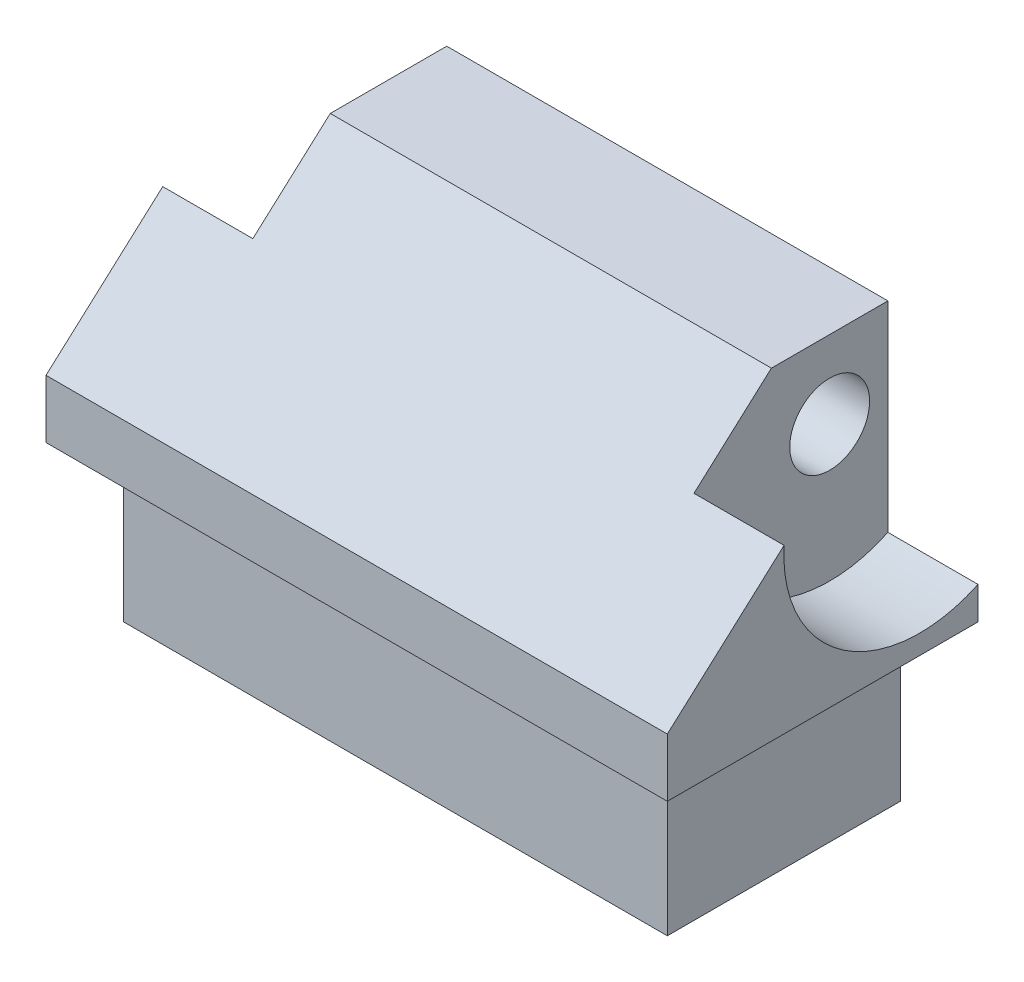
from build123d import *

# Parameters (mm, degrees)
SKETCH2_W           = 44.45
SKETCH2_H           = 19.05
BOSS_EXTRUDE1_DEPTH = 12.7
SKETCH3_W           = 50.8
SKETCH3_H           = 25.4
BOSS_EXTRUDE2_DEPTH = 3.175
BOSS_EXTRUDE3_DEPTH = 25.4
SKETCH5_R           = 11.1125
CUT_EXTRUDE1_DEPTH  = 7.366
SKETCH6_R           = 3.2639
CUT_EXTRUDE2_DEPTH  = 50.098929275


with BuildPart() as part:
    # Sketch2 → Boss-Extrude1 (new body)
    with BuildSketch(Plane(origin=(0, 0, 0), x_dir=(1, 0, 0), z_dir=(0, 1, 0))):
        Rectangle(SKETCH2_W, SKETCH2_H)
    extrude(amount=-BOSS_EXTRUDE1_DEPTH)

    # Sketch3 → Boss-Extrude2 (add)
    with BuildSketch(Plane(origin=(0, 0, 0), x_dir=(1, 0, 0), z_dir=(0, 1, 0))):
        Rectangle(SKETCH3_W, SKETCH3_H)
    extrude(amount=BOSS_EXTRUDE2_DEPTH)

    # Sketch4 → Boss-Extrude3 (add, symmetric)
    with BuildSketch(Plane(origin=(0, 0, 0), x_dir=(0, 0, -1), z_dir=(1, 0, 0))):
        Polygon((-12.7, 3.175), (-12.7, 4.7625), (3.175, 19.05), (12.7, 19.05), (12.7, 3.175), align=None)
    extrude(amount=BOSS_EXTRUDE3_DEPTH, both=True)

    # Sketch5 → Cut-Extrude1 (cut)
    with BuildSketch(Plane(origin=(25.4, 0, 0), x_dir=(0, 0, -1), z_dir=(1, 0, 0))):
        with Locations((7.9375, 12.7)):
            Circle(SKETCH5_R)
    cut_extrude1 = extrude(amount=-CUT_EXTRUDE1_DEPTH, mode=Mode.SUBTRACT)

    # Sketch6 → Cut-Extrude2 (cut, through all)
    with BuildSketch(Plane(origin=(18.034, 0, 0), x_dir=(0, 0, -1), z_dir=(1, 0, 0))):
        with Locations((7.9375, 12.7)):
            Circle(SKETCH6_R)
    extrude(amount=-CUT_EXTRUDE2_DEPTH, mode=Mode.SUBTRACT)

    # Mirror1: Cut-Extrude1 across plane
    add(cut_extrude1.mirror(Plane(origin=(0, 0, 0), x_dir=(0, 0, 1), z_dir=(1, 0, 0))), mode=Mode.SUBTRACT)


solid = part.part
